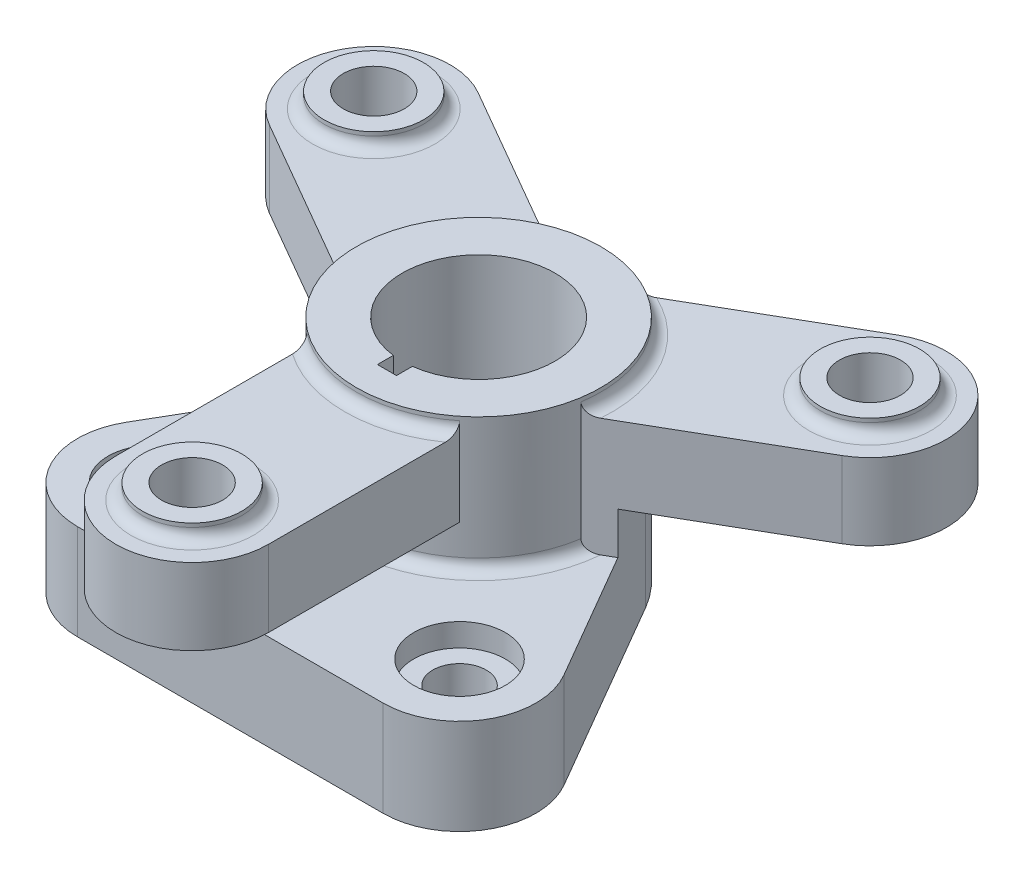
from build123d import *

# Parameters (mm, degrees)
SKETCH1_R                = 12
SKETCH1_R_2              = 7
BOSS_EXTRUDE4_DEPTH      = 25
BOSS_EXTRUDE5_START      = 11
SKETCH1_8_R              = 13
BOSS_EXTRUDE5_DEPTH      = 20
BOSS_EXTRUDE6_START      = 11
SKETCH1_9_R              = 8
SKETCH1_9_R_2            = 13
BOSS_EXTRUDE6_DEPTH      = 24
BOSS_EXTRUDE7_DEPTH      = 35
BOSS_EXTRUDE7_DEPTH_BACK = 25
SKETCH1_10_R             = 32
SKETCH2_R                = 12
CUT_EXTRUDE1_DEPTH       = 6
BOSS_EXTRUDE8_DEPTH      = 31
FILLET2_R                = 3


with BuildPart() as part:
    # Sketch1 → Boss-Extrude4 (new body)
    # profile 1 of 8: a face of its own
    with BuildSketch(Plane(origin=(0, 0, 0), x_dir=(1, 0, 0), z_dir=(0, 1, 0))):
        with BuildLine():
            Line((-20, -65), (-20, -24.979991994))
            ThreePointArc((-20, -24.979991994), (-27.712812921, -16), (-31.633307653, -4.830512079))
            Line((-31.633307653, -4.830512079), (-37.754300122, -1.296555429))
            Line((-37.754300122, -1.296555429), (-57.296551724, -34.95862069))
            ThreePointArc((-57.296551724, -34.95862069), (-57.332449137, -54.979288897), (-40, -65))
            Line((-40, -65), (-20, -65))
        make_face()
        with Locations((-40, -45)):
            Circle(SKETCH1_R, mode=Mode.SUBTRACT)
    # profile 2 of 8: a face of its own
    with BuildSketch(Plane(origin=(0, 0, 0), x_dir=(1, 0, 0), z_dir=(0, 1, 0))):
        with BuildLine():
            Line((37.754300122, -1.296555429), (31.633307653, -4.830512079))
            ThreePointArc((31.633307653, -4.830512079), (27.712812921, -16), (20, -24.979991994))
            Line((20, -24.979991994), (20, -65))
            Line((20, -65), (40, -65))
            ThreePointArc((40, -65), (57.332449137, -54.979288897), (57.296551724, -34.95862069))
            Line((57.296551724, -34.95862069), (37.754300122, -1.296555429))
        make_face()
        with Locations((40, -45)):
            Circle(SKETCH1_R, mode=Mode.SUBTRACT)
    # profile 3 of 8: a face of its own
    with BuildSketch(Plane(origin=(0, 0, 0), x_dir=(1, 0, 0), z_dir=(0, 1, 0))):
        with BuildLine():
            Line((20, -65), (20, -24.979991994))
            ThreePointArc((20, -24.979991994), (0, -32), (-20, -24.979991994))
            Line((-20, -24.979991994), (-20, -65))
            Line((-20, -65), (-8.306623863, -65))
            ThreePointArc((-8.306623863, -65), (0, -62), (8.306623863, -65))
            Line((8.306623863, -65), (20, -65))
        make_face()
    # profile 4 of 8: a face of its own
    with BuildSketch(Plane(origin=(0, 0, 0), x_dir=(1, 0, 0), z_dir=(0, 1, 0))):
        with BuildLine():
            Line((-8.306623863, -65), (8.306623863, -65))
            ThreePointArc((8.306623863, -65), (0, -62), (-8.306623863, -65))
        make_face()
    # profile 5 of 8: a face of its own
    with BuildSketch(Plane(origin=(0, 0, 0), x_dir=(1, 0, 0), z_dir=(0, 1, 0))):
        with BuildLine():
            Line((-37.754300122, -1.296555429), (-31.633307653, -4.830512079))
            ThreePointArc((-31.633307653, -4.830512079), (-31.440765208, 5.956364927), (-27.674482759, 16.066206897))
            Line((-27.674482759, 16.066206897), (-37.754300122, -1.296555429))
        make_face()
    # profile 6 of 8: a face of its own
    with BuildSketch(Plane(origin=(0, 0, 0), x_dir=(1, 0, 0), z_dir=(0, 1, 0))):
        with BuildLine():
            ThreePointArc((32, 0), (31.908195224, -2.422205102), (31.633307653, -4.830512079))
            Line((31.633307653, -4.830512079), (37.754300122, -1.296555429))
            Line((37.754300122, -1.296555429), (27.674482759, 16.066206897))
            ThreePointArc((27.674482759, 16.066206897), (30.899704273, 8.31915115), (32, 0))
        make_face()
    # profile 7 of 8: a face of its own
    with BuildSketch(Plane(origin=(0, 0, 0), x_dir=(1, 0, 0), z_dir=(0, 1, 0))):
        with Locations((-40, -45)):
            Circle(SKETCH1_R)
        with Locations(Location((-40, -45, 0), (0, 0, 270))):
            Circle(SKETCH1_R_2, mode=Mode.SUBTRACT)
    # profile 8 of 8: a face of its own
    with BuildSketch(Plane(origin=(0, 0, 0), x_dir=(1, 0, 0), z_dir=(0, 1, 0))):
        with Locations((40, -45)):
            Circle(SKETCH1_R)
        with Locations(Location((40, -45, 0), (0, 0, 270))):
            Circle(SKETCH1_R_2, mode=Mode.SUBTRACT)
    extrude(amount=-BOSS_EXTRUDE4_DEPTH)



with BuildPart() as body_2:
    # Sketch1<8> → Boss-Extrude5 (new body)
    # profile 1 of 4: a face of its own
    with BuildSketch(Plane(origin=(0, 0, 0), x_dir=(1, 0, 0), z_dir=(0, 1, 0)).offset(BOSS_EXTRUDE5_START)):
        with BuildLine():
            Line((20, -65), (20, -24.979991994))
            ThreePointArc((20, -24.979991994), (0, -32), (-20, -24.979991994))
            Line((-20, -24.979991994), (-20, -65))
            Line((-20, -65), (-8.306623863, -65))
            ThreePointArc((-8.306623863, -65), (0, -62), (8.306623863, -65))
            Line((8.306623863, -65), (20, -65))
        make_face()
    # profile 2 of 4: a face of its own
    with BuildSketch(Plane(origin=(0, 0, 0), x_dir=(1, 0, 0), z_dir=(0, 1, 0)).offset(BOSS_EXTRUDE5_START)):
        with BuildLine():
            Line((20, -75), (20, -65))
            Line((20, -65), (8.306623863, -65))
            ThreePointArc((8.306623863, -65), (11.768307232, -69.476690766), (13, -75))
            ThreePointArc((13, -75), (-5.523309234, -86.768307232), (-8.306623863, -65))
            Line((-8.306623863, -65), (-20, -65))
            Line((-20, -65), (-20, -75))
            ThreePointArc((-20, -75), (0, -95), (20, -75))
        make_face()
    # profile 3 of 4: a face of its own
    with BuildSketch(Plane(origin=(0, 0, 0), x_dir=(1, 0, 0), z_dir=(0, 1, 0)).offset(BOSS_EXTRUDE5_START)):
        with BuildLine():
            Line((27.674482759, 16.066206897), (37.754300122, -1.296555429))
            Line((37.754300122, -1.296555429), (74.951905284, 20.179491924))
            ThreePointArc((74.951905284, 20.179491924), (82.27241336, 47.5), (54.951905284, 54.820508076))
            Line((54.951905284, 54.820508076), (11.633307653, 29.810504072))
            ThreePointArc((11.633307653, 29.810504072), (20.820711394, 24.300164136), (27.674482759, 16.066206897))
        make_face()
        with Locations(Location((64.951905284, 37.5, 0), (0, 0, 270))):
            Circle(SKETCH1_8_R, mode=Mode.SUBTRACT)
    # profile 4 of 4: a face of its own
    with BuildSketch(Plane(origin=(0, 0, 0), x_dir=(1, 0, 0), z_dir=(0, 1, 0)).offset(BOSS_EXTRUDE5_START)):
        with BuildLine():
            ThreePointArc((-27.674482759, 16.066206897), (-20.820711394, 24.300164136), (-11.633307653, 29.810504072))
            Line((-11.633307653, 29.810504072), (-54.951905284, 54.820508076))
            ThreePointArc((-54.951905284, 54.820508076), (-82.27241336, 47.5), (-74.951905284, 20.179491924))
            Line((-74.951905284, 20.179491924), (-37.754300122, -1.296555429))
            Line((-37.754300122, -1.296555429), (-27.674482759, 16.066206897))
        make_face()
        with Locations(Location((-64.951905284, 37.5, 0), (0, 0, 270))):
            Circle(SKETCH1_8_R, mode=Mode.SUBTRACT)
    extrude(amount=BOSS_EXTRUDE5_DEPTH)

    # Sketch1<9> → Boss-Extrude6 (add)
    # profile 1 of 4: a face of its own
    with BuildSketch(Plane(origin=(0, 0, 0), x_dir=(1, 0, 0), z_dir=(0, 1, 0)).offset(BOSS_EXTRUDE6_START)):
        with BuildLine():
            ThreePointArc((13, -75), (11.768307232, -69.476690766), (8.306623863, -65))
            Line((8.306623863, -65), (-8.306623863, -65))
            ThreePointArc((-8.306623863, -65), (-5.523309234, -86.768307232), (13, -75))
        make_face()
        with Locations(Location((0, -75, 0), (0, 0, 270))):
            Circle(SKETCH1_9_R, mode=Mode.SUBTRACT)
    # profile 2 of 4: a face of its own
    with BuildSketch(Plane(origin=(0, 0, 0), x_dir=(1, 0, 0), z_dir=(0, 1, 0)).offset(BOSS_EXTRUDE6_START)):
        with Locations(Location((64.951905284, 37.5, 0), (0, 0, 270))):
            Circle(SKETCH1_9_R_2)
        with Locations(Location((64.951905284, 37.5, 0), (0, 0, 270))):
            Circle(SKETCH1_9_R, mode=Mode.SUBTRACT)
    # profile 3 of 4: a face of its own
    with BuildSketch(Plane(origin=(0, 0, 0), x_dir=(1, 0, 0), z_dir=(0, 1, 0)).offset(BOSS_EXTRUDE6_START)):
        with Locations(Location((-64.951905284, 37.5, 0), (0, 0, 270))):
            Circle(SKETCH1_9_R_2)
        with Locations(Location((-64.951905284, 37.5, 0), (0, 0, 270))):
            Circle(SKETCH1_9_R, mode=Mode.SUBTRACT)
    # profile 4 of 4: a face of its own
    with BuildSketch(Plane(origin=(0, 0, 0), x_dir=(1, 0, 0), z_dir=(0, 1, 0)).offset(BOSS_EXTRUDE6_START)):
        with BuildLine():
            Line((-8.306623863, -65), (8.306623863, -65))
            ThreePointArc((8.306623863, -65), (0, -62), (-8.306623863, -65))
        make_face()
    extrude(amount=BOSS_EXTRUDE6_DEPTH)


with BuildPart() as part_1:
    add(part.part)

    add(body_2.part)  # Boss-Extrude7 merges body 2
    # Sketch1<10> → Boss-Extrude7 (add, two sides: drawn at the far end of the back side and taken through both)
    with BuildSketch(Plane(origin=(0, 0, 0), x_dir=(1, 0, 0), z_dir=(0, 1, 0)).offset(-BOSS_EXTRUDE7_DEPTH_BACK)):
        with Locations(Location((0, 0, 0), (0, 0, 270))):
            Circle(SKETCH1_10_R)
        with BuildLine():
            ThreePointArc((2.5, -19.843134833), (0, 20), (-2.5, -19.843134833))
            Line((-2.5, -19.843134833), (-2.5, -24))
            Line((-2.5, -24), (2.5, -24))
            Line((2.5, -24), (2.5, -19.843134833))
        make_face(mode=Mode.SUBTRACT)
    extrude(amount=BOSS_EXTRUDE7_DEPTH + BOSS_EXTRUDE7_DEPTH_BACK)

    # Sketch2 → Cut-Extrude1 (cut)
    with BuildSketch(Plane(origin=(0, 0, 0), x_dir=(1, 0, 0), z_dir=(0, 1, 0))):
        with Locations(Location((40, -45, 0), (0, 0, 270))):
            Circle(SKETCH2_R)
        with Locations(Location((-40, -45, 0), (0, 0, 270))):
            Circle(SKETCH2_R)
    extrude(amount=-CUT_EXTRUDE1_DEPTH, mode=Mode.SUBTRACT)

    # Sketch1<11> → Boss-Extrude8 (add)
    with BuildSketch(Plane(origin=(0, 0, 0), x_dir=(1, 0, 0), z_dir=(0, 1, 0))):
        with BuildLine():
            Line((-37.754300122, -1.296555429), (-31.633307653, -4.830512079))
            ThreePointArc((-31.633307653, -4.830512079), (-31.440765208, 5.956364927), (-27.674482759, 16.066206897))
            Line((-27.674482759, 16.066206897), (-37.754300122, -1.296555429))
        make_face()
        with BuildLine():
            ThreePointArc((32, 0), (31.908195224, -2.422205102), (31.633307653, -4.830512079))
            Line((31.633307653, -4.830512079), (37.754300122, -1.296555429))
            Line((37.754300122, -1.296555429), (27.674482759, 16.066206897))
            ThreePointArc((27.674482759, 16.066206897), (30.899704273, 8.31915115), (32, 0))
        make_face()
    extrude(amount=BOSS_EXTRUDE8_DEPTH)

    # Fillet2
    fillet2_edges = [part_1.edges().sort_by_distance(p)[0] for p in [
        (-20.849743565, 0, 24.275258871),
        (10.598119083, 31, 30.194037026),
        (-13, 31, 75),
        (31.440765208, 31, -5.956364927),
        (64.951905284, 31, -50.5),
        (-31.440765208, 31, -5.956364927),
        (-64.951905284, 31, -50.5),
    ]]
    fillet(fillet2_edges, radius=FILLET2_R)


solid = part_1.part
